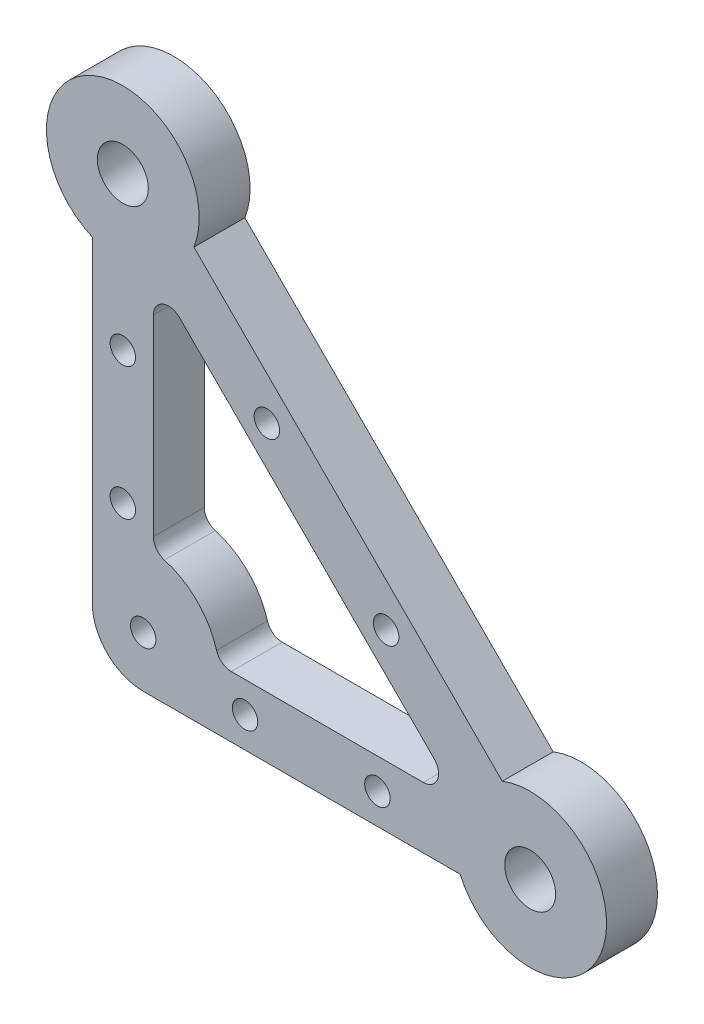
from build123d import *

# Parameters (mm, degrees)
ESBO_O1_R                = 5
ESBO_O1_R_2              = 2.5
RESSALTO_EXTRUS_O1_DEPTH = 10


with BuildPart() as part:
    # Esboço1 → Ressalto-extrusão1 (new body)
    with BuildSketch(Plane.XY):
        with BuildLine():
            Line((-6, -76), (-6, -13.747727085))
            ThreePointArc((-6, -13.747727085), (-5.740251485, 13.858192988), (13.963751735, -5.47847036))
            Line((13.963751735, -5.47847036), (74.52152964, -66.036248265))
            ThreePointArc((74.52152964, -66.036248265), (93.858192988, -85.740251485), (66.252272915, -86))
            Line((66.252272915, -86), (4, -86))
            ThreePointArc((4, -86), (-3.071067812, -83.071067812), (-6, -76))
        make_face()
        Circle(ESBO_O1_R, mode=Mode.SUBTRACT)
        with Locations((0, -30)):
            Circle(ESBO_O1_R_2, mode=Mode.SUBTRACT)
        with Locations((0, -56)):
            Circle(ESBO_O1_R_2, mode=Mode.SUBTRACT)
        with Locations((4, -76)):
            Circle(ESBO_O1_R_2, mode=Mode.SUBTRACT)
        with Locations((24, -80)):
            Circle(ESBO_O1_R_2, mode=Mode.SUBTRACT)
        with Locations((50, -80)):
            Circle(ESBO_O1_R_2, mode=Mode.SUBTRACT)
        with Locations((80, -80)):
            Circle(ESBO_O1_R, mode=Mode.SUBTRACT)
        with Locations((28.284271247, -28.284271247)):
            Circle(ESBO_O1_R_2, mode=Mode.SUBTRACT)
        with Locations((51.715728753, -51.715728753)):
            Circle(ESBO_O1_R_2, mode=Mode.SUBTRACT)
        with BuildLine():
            Line((21.291616466, -74), (59.009632228, -74))
            ThreePointArc((59.009632228, -74), (61.781270826, -72.148050297), (61.130952572, -68.878679656))
            Line((61.130952572, -68.878679656), (11.121320344, -18.869047428))
            ThreePointArc((11.121320344, -18.869047428), (7.851949703, -18.218729174), (6, -20.990367772))
            Line((6, -20.990367772), (6, -58.708383534))
            ThreePointArc((6, -58.708383534), (6.602084238, -60.511159172), (8.166666667, -61.590319612))
            ThreePointArc((8.166666667, -61.590319612), (14.606601718, -65.393398282), (18.409680388, -71.833333333))
            ThreePointArc((18.409680388, -71.833333333), (19.488840828, -73.397915762), (21.291616466, -74))
        make_face(mode=Mode.SUBTRACT)
    extrude(amount=RESSALTO_EXTRUS_O1_DEPTH)


solid = part.part
